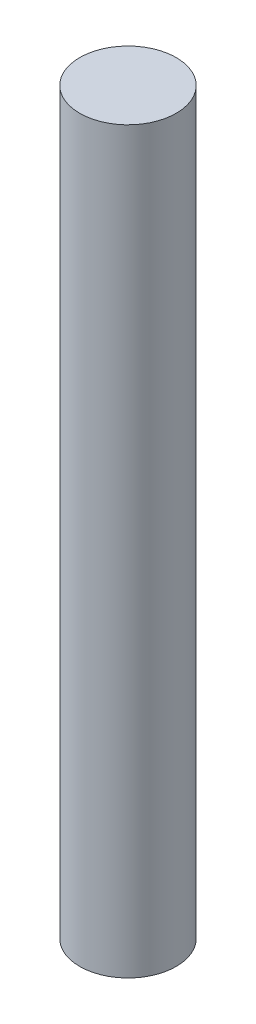
from build123d import *

# Parameters (mm, degrees)
SKETCH2_R           = 199.136
BOSS_EXTRUDE1_DEPTH = 3048


with BuildPart() as part:
    # Sketch2 → Boss-Extrude1 (new body)
    with BuildSketch(Plane(origin=(0, 0, 0), x_dir=(1, 0, 0), z_dir=(0, 1, 0))):
        with Locations(Location((0, 0, 0), (0, 0, 270))):
            Circle(SKETCH2_R)
    extrude(amount=BOSS_EXTRUDE1_DEPTH)


solid = part.part
